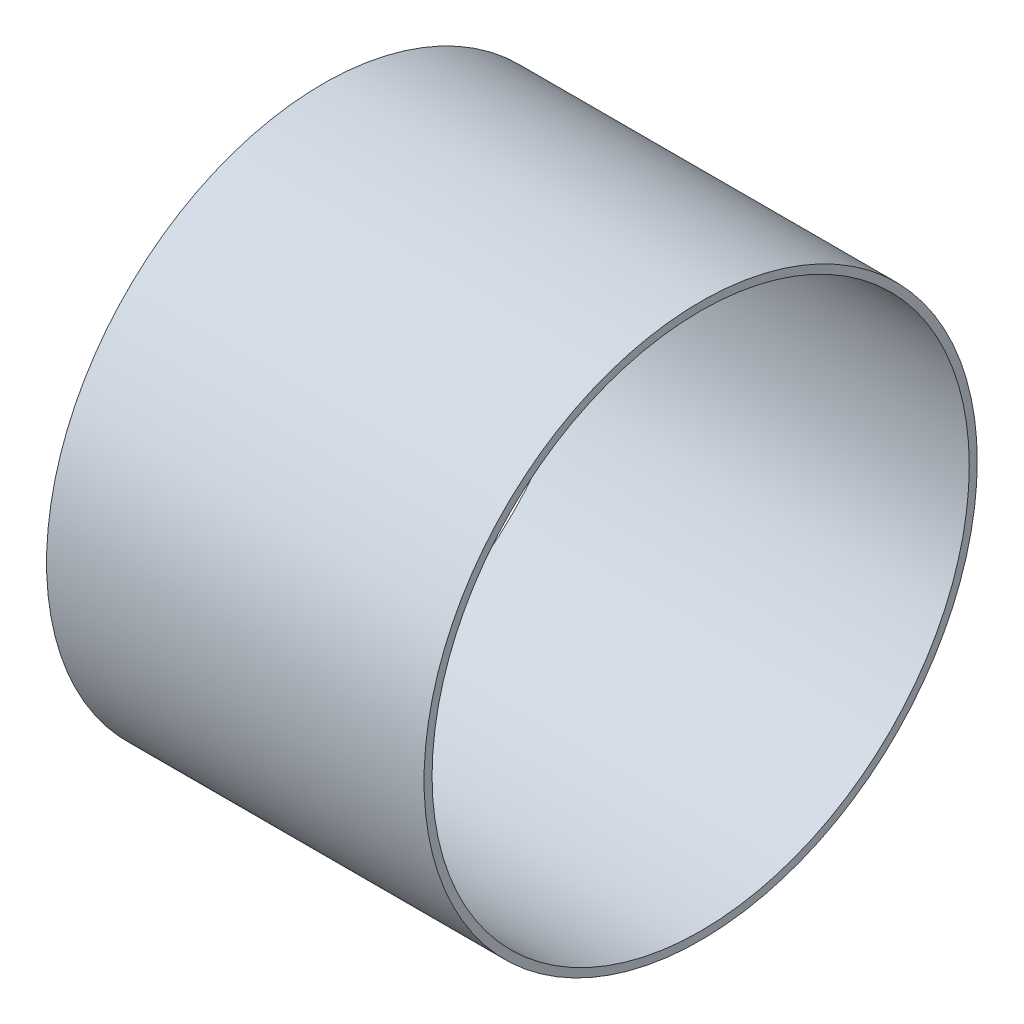
from build123d import *

# Parameters (mm, degrees)
SKETCH1_R           = 57.15
SKETCH1_R_2         = 55.499
BOSS_EXTRUDE1_DEPTH = 78


with BuildPart() as part:
    # Sketch1 → Boss-Extrude1 (new body)
    with BuildSketch(Plane(origin=(0, 0, 0), x_dir=(0, 0, -1), z_dir=(1, 0, 0))):
        Circle(SKETCH1_R)
        Circle(SKETCH1_R_2, mode=Mode.SUBTRACT)
    extrude(amount=BOSS_EXTRUDE1_DEPTH)


solid = part.part
